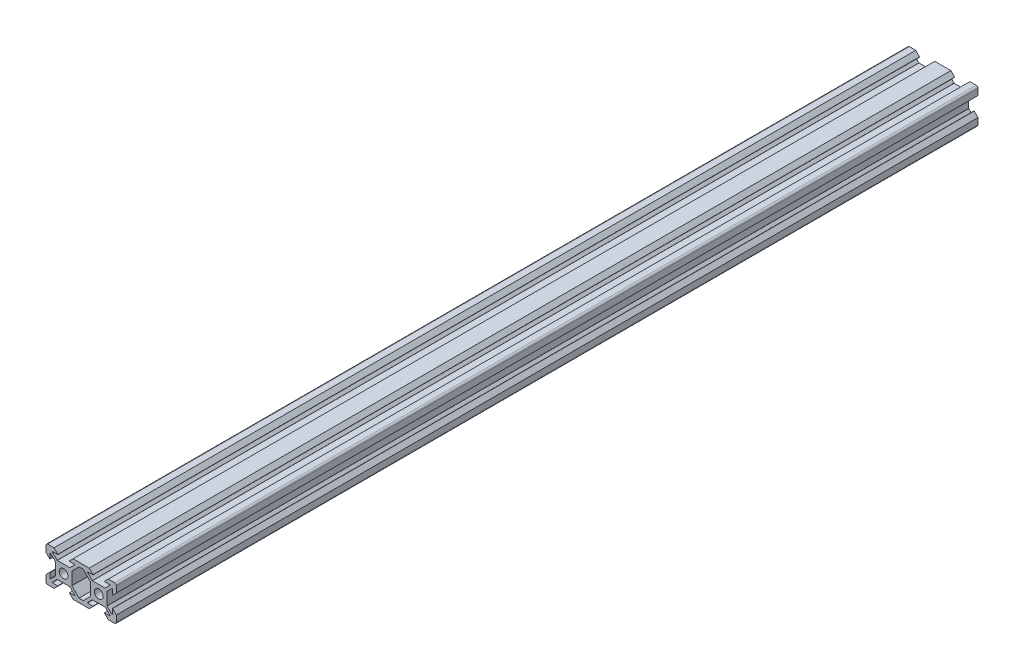
from build123d import *

# Parameters (mm, degrees)
CROQUIS4_R                 = 2.5
MIEMBRO_ESTRUCTURAL1_DEPTH = 490


with BuildPart() as part:
    # Croquis4 → Miembro estructural1 (new body)
    with BuildSketch(Plane.XY.offset(-245)):
        with BuildLine():
            Line((-19, -10), (-15.410285706, -10))
            Line((-15.410285706, -10), (-13.270710678, -7.860424973))
            ThreePointArc((-13.270710678, -7.860424973), (-13.249033403, -7.751445951), (-13.341421356, -7.689714294))
            Line((-13.341421356, -7.689714294), (-16.358578644, -7.689714294))
            ThreePointArc((-16.358578644, -7.689714294), (-16.450966597, -7.627982638), (-16.429289322, -7.519003616))
            Line((-16.429289322, -7.519003616), (-13.629289322, -4.719003616))
            ThreePointArc((-13.629289322, -4.719003616), (-13.596846987, -4.697326341), (-13.558578644, -4.689714294))
            Line((-13.558578644, -4.689714294), (-6.441421356, -4.689714294))
            ThreePointArc((-6.441421356, -4.689714294), (-6.403153013, -4.697326341), (-6.370710678, -4.719003616))
            Line((-6.370710678, -4.719003616), (-3.570710678, -7.519003616))
            ThreePointArc((-3.570710678, -7.519003616), (-3.549033403, -7.627982638), (-3.641421356, -7.689714294))
            Line((-3.641421356, -7.689714294), (-6.658578644, -7.689714294))
            ThreePointArc((-6.658578644, -7.689714294), (-6.750966597, -7.751445951), (-6.729289322, -7.860424973))
            Line((-6.729289322, -7.860424973), (-4.589714294, -10))
            Line((-4.589714294, -10), (4.589714294, -10))
            Line((4.589714294, -10), (6.729289322, -7.860424973))
            ThreePointArc((6.729289322, -7.860424973), (6.750966597, -7.751445951), (6.658578644, -7.689714294))
            Line((6.658578644, -7.689714294), (3.641421356, -7.689714294))
            ThreePointArc((3.641421356, -7.689714294), (3.549033403, -7.627982638), (3.570710678, -7.519003616))
            Line((3.570710678, -7.519003616), (6.370710678, -4.719003616))
            ThreePointArc((6.370710678, -4.719003616), (6.403153013, -4.697326341), (6.441421356, -4.689714294))
            Line((6.441421356, -4.689714294), (13.558578644, -4.689714294))
            ThreePointArc((13.558578644, -4.689714294), (13.596846987, -4.697326341), (13.629289322, -4.719003616))
            Line((13.629289322, -4.719003616), (16.429289322, -7.519003616))
            ThreePointArc((16.429289322, -7.519003616), (16.450966597, -7.627982638), (16.358578644, -7.689714294))
            Line((16.358578644, -7.689714294), (13.341421356, -7.689714294))
            ThreePointArc((13.341421356, -7.689714294), (13.249033403, -7.751445951), (13.270710678, -7.860424973))
            Line((13.270710678, -7.860424973), (15.410285706, -10))
            Line((15.410285706, -10), (19, -10))
            ThreePointArc((19, -10), (19.707106781, -9.707106781), (20, -9))
            Line((20, -9), (20, -5.410285706))
            Line((20, -5.410285706), (17.860424973, -3.270710678))
            ThreePointArc((17.860424973, -3.270710678), (17.751445951, -3.249033403), (17.689714294, -3.341421356))
            Line((17.689714294, -3.341421356), (17.689714294, -6.358578644))
            ThreePointArc((17.689714294, -6.358578644), (17.627982638, -6.450966597), (17.519003616, -6.429289322))
            Line((17.519003616, -6.429289322), (14.719003616, -3.629289322))
            ThreePointArc((14.719003616, -3.629289322), (14.697326341, -3.596846987), (14.689714294, -3.558578644))
            Line((14.689714294, -3.558578644), (14.689714294, 3.558578644))
            ThreePointArc((14.689714294, 3.558578644), (14.697326341, 3.596846987), (14.719003616, 3.629289322))
            Line((14.719003616, 3.629289322), (17.519003616, 6.429289322))
            ThreePointArc((17.519003616, 6.429289322), (17.627982638, 6.450966597), (17.689714294, 6.358578644))
            Line((17.689714294, 6.358578644), (17.689714294, 3.341421356))
            ThreePointArc((17.689714294, 3.341421356), (17.751445951, 3.249033403), (17.860424973, 3.270710678))
            Line((17.860424973, 3.270710678), (20, 5.410285706))
            Line((20, 5.410285706), (20, 9))
            ThreePointArc((20, 9), (19.707106781, 9.707106781), (19, 10))
            Line((19, 10), (15.410285706, 10))
            Line((15.410285706, 10), (13.270710678, 7.860424973))
            ThreePointArc((13.270710678, 7.860424973), (13.249033403, 7.751445951), (13.341421356, 7.689714294))
            Line((13.341421356, 7.689714294), (16.358578644, 7.689714294))
            ThreePointArc((16.358578644, 7.689714294), (16.450966597, 7.627982638), (16.429289322, 7.519003616))
            Line((16.429289322, 7.519003616), (13.629289322, 4.719003616))
            ThreePointArc((13.629289322, 4.719003616), (13.596846987, 4.697326341), (13.558578644, 4.689714294))
            Line((13.558578644, 4.689714294), (6.441421356, 4.689714294))
            ThreePointArc((6.441421356, 4.689714294), (6.403153013, 4.697326341), (6.370710678, 4.719003616))
            Line((6.370710678, 4.719003616), (3.570710678, 7.519003616))
            ThreePointArc((3.570710678, 7.519003616), (3.549033403, 7.627982638), (3.641421356, 7.689714294))
            Line((3.641421356, 7.689714294), (6.658578644, 7.689714294))
            ThreePointArc((6.658578644, 7.689714294), (6.750966597, 7.751445951), (6.729289322, 7.860424973))
            Line((6.729289322, 7.860424973), (4.589714294, 10))
            Line((4.589714294, 10), (-4.589714294, 10))
            Line((-4.589714294, 10), (-6.729289322, 7.860424973))
            ThreePointArc((-6.729289322, 7.860424973), (-6.750966597, 7.751445951), (-6.658578644, 7.689714294))
            Line((-6.658578644, 7.689714294), (-3.641421356, 7.689714294))
            ThreePointArc((-3.641421356, 7.689714294), (-3.549033403, 7.627982638), (-3.570710678, 7.519003616))
            Line((-3.570710678, 7.519003616), (-6.370710678, 4.719003616))
            ThreePointArc((-6.370710678, 4.719003616), (-6.403153013, 4.697326341), (-6.441421356, 4.689714294))
            Line((-6.441421356, 4.689714294), (-13.558578644, 4.689714294))
            ThreePointArc((-13.558578644, 4.689714294), (-13.596846987, 4.697326341), (-13.629289322, 4.719003616))
            Line((-13.629289322, 4.719003616), (-16.429289322, 7.519003616))
            ThreePointArc((-16.429289322, 7.519003616), (-16.450966597, 7.627982638), (-16.358578644, 7.689714294))
            Line((-16.358578644, 7.689714294), (-13.341421356, 7.689714294))
            ThreePointArc((-13.341421356, 7.689714294), (-13.249033403, 7.751445951), (-13.270710678, 7.860424973))
            Line((-13.270710678, 7.860424973), (-15.410285706, 10))
            Line((-15.410285706, 10), (-19, 10))
            ThreePointArc((-19, 10), (-19.707106781, 9.707106781), (-20, 9))
            Line((-20, 9), (-20, 5.410285706))
            Line((-20, 5.410285706), (-17.860424973, 3.270710678))
            ThreePointArc((-17.860424973, 3.270710678), (-17.751445951, 3.249033403), (-17.689714294, 3.341421356))
            Line((-17.689714294, 3.341421356), (-17.689714294, 6.358578644))
            ThreePointArc((-17.689714294, 6.358578644), (-17.627982638, 6.450966597), (-17.519003616, 6.429289322))
            Line((-17.519003616, 6.429289322), (-14.719003616, 3.629289322))
            ThreePointArc((-14.719003616, 3.629289322), (-14.697326341, 3.596846987), (-14.689714294, 3.558578644))
            Line((-14.689714294, 3.558578644), (-14.689714294, -3.558578644))
            ThreePointArc((-14.689714294, -3.558578644), (-14.697326341, -3.596846987), (-14.719003616, -3.629289322))
            Line((-14.719003616, -3.629289322), (-17.519003616, -6.429289322))
            ThreePointArc((-17.519003616, -6.429289322), (-17.627982638, -6.450966597), (-17.689714294, -6.358578644))
            Line((-17.689714294, -6.358578644), (-17.689714294, -3.341421356))
            ThreePointArc((-17.689714294, -3.341421356), (-17.751445951, -3.249033403), (-17.860424973, -3.270710678))
            Line((-17.860424973, -3.270710678), (-20, -5.410285706))
            Line((-20, -5.410285706), (-20, -9))
            ThreePointArc((-20, -9), (-19.707106781, -9.707106781), (-19, -10))
        make_face()
        with Locations((-10, 0)):
            Circle(CROQUIS4_R, mode=Mode.SUBTRACT)
        with Locations((10, 0)):
            Circle(CROQUIS4_R, mode=Mode.SUBTRACT)
        with BuildLine():
            Line((-2.480996384, 6.429289322), (-5.280996384, 3.629289322))
            ThreePointArc((-5.280996384, 3.629289322), (-5.302673659, 3.596846987), (-5.310285706, 3.558578644))
            Line((-5.310285706, 3.558578644), (-5.310285706, -3.558578644))
            ThreePointArc((-5.310285706, -3.558578644), (-5.302673659, -3.596846987), (-5.280996384, -3.629289322))
            Line((-5.280996384, -3.629289322), (-2.480996384, -6.429289322))
            Line((-2.480996384, -6.429289322), (-1.220571411, -7.689714294))
            Line((-1.220571411, -7.689714294), (1.220571411, -7.689714294))
            Line((1.220571411, -7.689714294), (2.480996384, -6.429289322))
            Line((2.480996384, -6.429289322), (5.280996384, -3.629289322))
            ThreePointArc((5.280996384, -3.629289322), (5.302673659, -3.596846987), (5.310285706, -3.558578644))
            Line((5.310285706, -3.558578644), (5.310285706, 3.558578644))
            ThreePointArc((5.310285706, 3.558578644), (5.302673659, 3.596846987), (5.280996384, 3.629289322))
            Line((5.280996384, 3.629289322), (2.480996384, 6.429289322))
            Line((2.480996384, 6.429289322), (1.220571411, 7.689714294))
            Line((1.220571411, 7.689714294), (-1.220571411, 7.689714294))
            Line((-1.220571411, 7.689714294), (-2.480996384, 6.429289322))
        make_face(mode=Mode.SUBTRACT)
    extrude(amount=MIEMBRO_ESTRUCTURAL1_DEPTH)


solid = part.part
